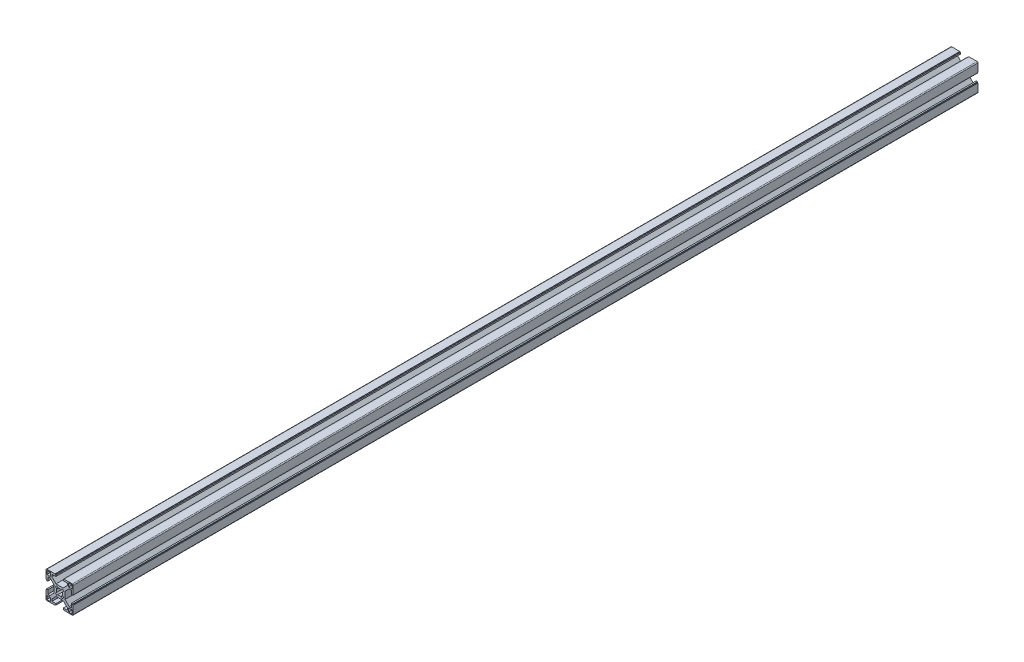
from build123d import *

# Parameters (mm, degrees)
ESBO_O1_W                = 4
ESBO_O1_H                = 4
RESSALTO_EXTRUS_O1_DEPTH = 1000
PADR_OCIRCULAR1_COUNT    = 4
FILETE1_R                = 1


with BuildPart() as part:
    # Esboço1 → Ressalto-extrusão1 (new body)
    with BuildSketch(Plane.XY):
        with BuildLine():
            ThreePointArc((-1.664601464, 3.078815026), (-0.858529967, 3.393070335), (0, 3.5))
            Line((0, 3.5), (0, 6))
            Line((0, 6), (-3.878679656, 6))
            Line((-3.878679656, 6), (-8.5, 10.621320344))
            Line((-8.5, 10.621320344), (-8.5, 13))
            Line((-8.5, 13), (-4.1, 13))
            Line((-4.1, 13), (-4.1, 14.5))
            Line((-4.1, 14.5), (-5.1, 14.5))
            Line((-5.1, 14.5), (-5.1, 15))
            Line((-5.1, 15), (-15, 15))
            Line((-15, 15), (-15, 5.1))
            Line((-15, 5.1), (-14.5, 5.1))
            Line((-14.5, 5.1), (-14.5, 4.1))
            Line((-14.5, 4.1), (-13, 4.1))
            Line((-13, 4.1), (-13, 8.5))
            Line((-13, 8.5), (-10.621320344, 8.5))
            Line((-10.621320344, 8.5), (-6, 3.878679656))
            Line((-6, 3.878679656), (-6, 0))
            Line((-6, 0), (-3.5, 0))
            ThreePointArc((-3.5, 0), (-3.393070335, 0.858529967), (-3.078815026, 1.664601464))
            Line((-3.078815026, 1.664601464), (-4.596194078, 3.181980515))
            Line((-4.596194078, 3.181980515), (-3.181980515, 4.596194078))
            Line((-3.181980515, 4.596194078), (-1.664601464, 3.078815026))
        make_face()
        with Locations((-12, 12)):
            Rectangle(ESBO_O1_W, ESBO_O1_H, mode=Mode.SUBTRACT)
    ressalto_extrus_o1 = extrude(amount=RESSALTO_EXTRUS_O1_DEPTH)

    # PadrãoCircular1: Ressalto-extrusão1 ×4 about axis
    padr_ocircular1_axis = Axis((0, 0, 0), (0, 0, 1))
    for i in range(1, PADR_OCIRCULAR1_COUNT):
        add(ressalto_extrus_o1.rotate(padr_ocircular1_axis, i * 360 / PADR_OCIRCULAR1_COUNT))

    # Filete1
    filete1_edges = [part.edges().sort_by_distance(p)[0] for p in [
        (15, -15, 500),
        (15, 15, 500),
        (-15, 15, 500),
        (-15, -15, 500),
    ]]
    fillet(filete1_edges, radius=FILETE1_R)


solid = part.part
